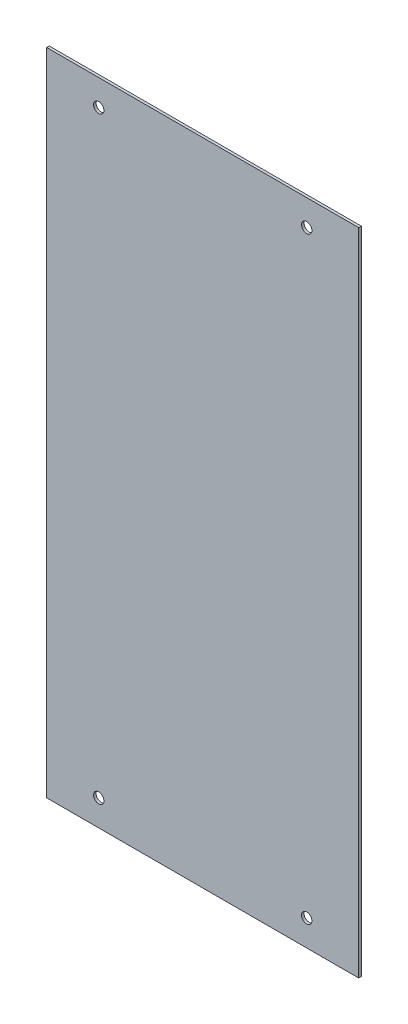
from build123d import *

# Parameters (mm, degrees)
ESQUISSE1_W        = 120
ESQUISSE1_H        = 250
ESQUISSE1_R        = 2
BOSS_EXTRU_1_DEPTH = 1


with BuildPart() as part:
    # Esquisse1 → Boss.-Extru.1 (new body)
    with BuildSketch(Plane.XY):
        with Locations((60, 125)):
            Rectangle(ESQUISSE1_W, ESQUISSE1_H)
        with Locations((20, 240)):
            Circle(ESQUISSE1_R, mode=Mode.SUBTRACT)
        with Locations((100, 240)):
            Circle(ESQUISSE1_R, mode=Mode.SUBTRACT)
        with Locations((100, 10)):
            Circle(ESQUISSE1_R, mode=Mode.SUBTRACT)
        with Locations((20, 10)):
            Circle(ESQUISSE1_R, mode=Mode.SUBTRACT)
    extrude(amount=BOSS_EXTRU_1_DEPTH)


solid = part.part
